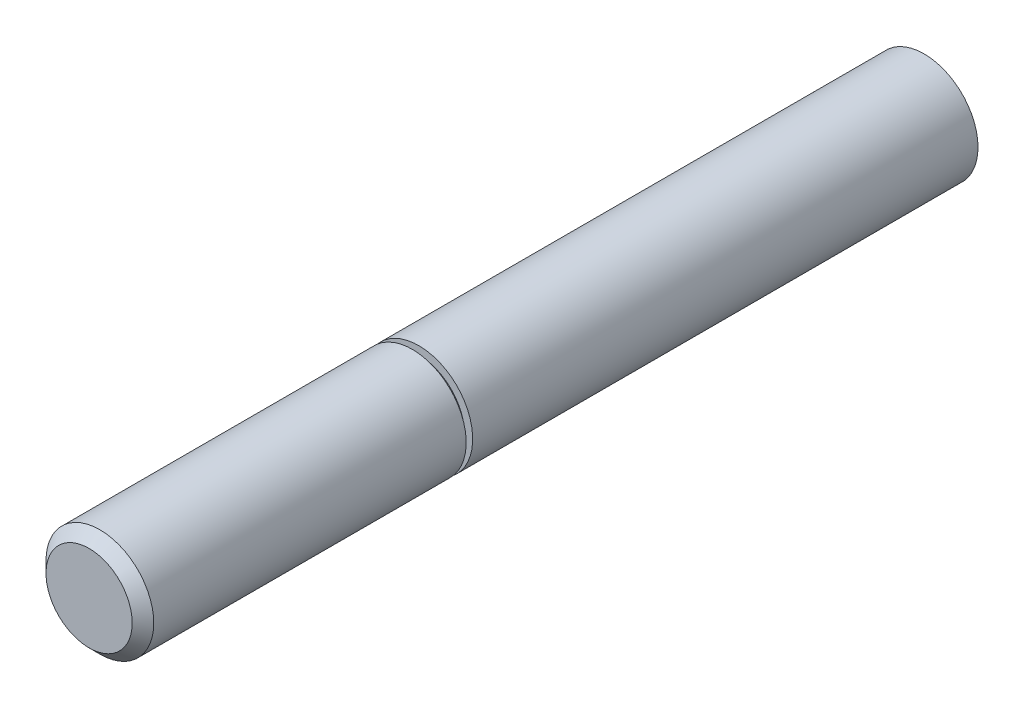
from build123d import *

# Parameters (mm, degrees)
SZKIC1_R                    = 10
DODANIE_WYCI_GNI_CIE1_DEPTH = 155
SFAZOWANIE2_SIZE            = 2
SZKIC2_W                    = 1.5
SZKIC2_H                    = 1.2


with BuildPart() as part:
    # Szkic1 → Dodanie-wyciągnięcie1 (new body)
    with BuildSketch(Plane.XY):
        Circle(SZKIC1_R)
    extrude(amount=DODANIE_WYCI_GNI_CIE1_DEPTH)

    # Sfazowanie2
    sfazowanie2_edges = [part.edges().sort_by_distance(p)[0] for p in [
        (-10, 0, 155),
    ]]
    chamfer(sfazowanie2_edges, length=SFAZOWANIE2_SIZE)

    # Szkic2 → Wycięcie-obrót1 (revolve, cut)
    with BuildSketch(Plane(origin=(0, 0, 0), x_dir=(1, 0, 0), z_dir=(0, 1, 0)), mode=Mode.PRIVATE) as wyci_cie_obr_t1_sk:
        with Locations((9.25, -94.4)):
            Rectangle(SZKIC2_W, SZKIC2_H)
    revolve(wyci_cie_obr_t1_sk.sketch.rotate(Axis((0, 0, 0), (0, 0, 1)), 180), axis=Axis((0, 0, 0), (0, 0, 1)), mode=Mode.SUBTRACT)


solid = part.part
